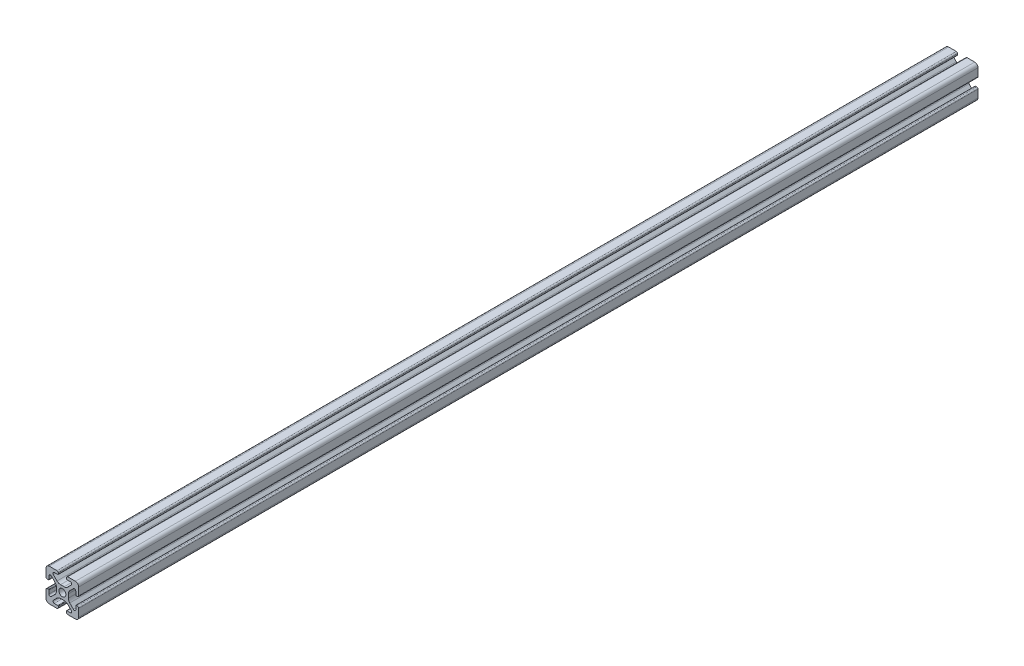
from build123d import *

# Parameters (mm, degrees)
BOSS_EXTRU_1_DEPTH = 550


with BuildPart() as part:
    # Esquisse1 → Boss.-Extru.1 (new body)
    with BuildSketch(Plane.XY):
        with BuildLine():
            Line((-3.255887446, 4.528679645), (-5.506192286, 6.778984485))
            ThreePointArc((-5.506192286, 6.778984485), (-5.686636441, 7.686138511), (-4.917588391, 8.199999989))
            Line((-4.917588391, 8.199999989), (-2.799999991, 8.199999989))
            ThreePointArc((-2.799999991, 8.199999989), (-2.587867957, 8.287867955), (-2.499999991, 8.499999989))
            Line((-2.499999991, 8.499999989), (-2.499999991, 9.199999989))
            ThreePointArc((-2.499999991, 9.199999989), (-2.734314566, 9.765685414), (-3.299999991, 9.999999989))
            Line((-3.299999991, 9.999999989), (-7.999999991, 9.999999989))
            ThreePointArc((-7.999999991, 9.999999989), (-9.414213554, 9.414213552), (-9.999999991, 7.999999989))
            Line((-9.999999991, 7.999999989), (-9.999999991, 3.299999989))
            ThreePointArc((-9.999999991, 3.299999989), (-9.765685416, 2.734314564), (-9.199999991, 2.499999989))
            Line((-9.199999991, 2.499999989), (-8.499999991, 2.499999989))
            ThreePointArc((-8.499999991, 2.499999989), (-8.287867957, 2.587867955), (-8.199999991, 2.799999989))
            Line((-8.199999991, 2.799999989), (-8.199999991, 4.917588389))
            ThreePointArc((-8.199999991, 4.917588389), (-7.686138517, 5.686636433), (-6.778984497, 5.506192279))
            Line((-6.778984497, 5.506192279), (-4.528679657, 3.255887439))
            ThreePointArc((-4.528679657, 3.255887439), (-3.878361403, 2.282617393), (-3.650000001, 1.134567096))
            Line((-3.650000001, 1.134567096), (-3.650000001, -1.134567114))
            ThreePointArc((-3.650000001, -1.134567114), (-3.878361403, -2.282617409), (-4.528679656, -3.255887454))
            Line((-4.528679656, -3.255887454), (-6.778984496, -5.506192294))
            ThreePointArc((-6.778984496, -5.506192294), (-7.686138522, -5.686636449), (-8.2, -4.9175884))
            Line((-8.2, -4.9175884), (-8.2, -2.8))
            ThreePointArc((-8.2, -2.8), (-8.287867966, -2.587867966), (-8.5, -2.5))
            Line((-8.5, -2.5), (-9.2, -2.5))
            ThreePointArc((-9.2, -2.5), (-9.765685425, -2.734314575), (-10, -3.3))
            Line((-10, -3.3), (-10, -8))
            ThreePointArc((-10, -8), (-9.414213562, -9.414213562), (-8, -10))
            Line((-8, -10), (-3.3, -10))
            ThreePointArc((-3.3, -10), (-2.734314575, -9.765685425), (-2.5, -9.2))
            Line((-2.5, -9.2), (-2.5, -8.5))
            ThreePointArc((-2.5, -8.5), (-2.587867966, -8.287867966), (-2.8, -8.2))
            Line((-2.8, -8.2), (-4.9175884, -8.2))
            ThreePointArc((-4.9175884, -8.2), (-5.686636444, -7.686138526), (-5.50619229, -6.778984506))
            Line((-5.50619229, -6.778984506), (-3.25588745, -4.528679666))
            ThreePointArc((-3.25588745, -4.528679666), (-2.282617404, -3.878361412), (-1.134567106, -3.650000009))
            Line((-1.134567106, -3.650000009), (1.134567104, -3.650000009))
            ThreePointArc((1.134567104, -3.650000009), (2.282617399, -3.878361412), (3.255887444, -4.528679664))
            Line((3.255887444, -4.528679664), (5.506192284, -6.778984504))
            ThreePointArc((5.506192284, -6.778984504), (5.686636439, -7.686138531), (4.917588389, -8.200000009))
            Line((4.917588389, -8.200000009), (2.799999989, -8.200000009))
            ThreePointArc((2.799999989, -8.200000009), (2.587867955, -8.287867974), (2.499999989, -8.500000009))
            Line((2.499999989, -8.500000009), (2.499999989, -9.200000009))
            ThreePointArc((2.499999989, -9.200000009), (2.734314564, -9.765685434), (3.299999989, -10.000000009))
            Line((3.299999989, -10.000000009), (7.999999989, -10.000000009))
            ThreePointArc((7.999999989, -10.000000009), (9.414213552, -9.414213571), (9.999999989, -8.000000009))
            Line((9.999999989, -8.000000009), (9.999999989, -3.300000009))
            ThreePointArc((9.999999989, -3.300000009), (9.765685414, -2.734314584), (9.199999989, -2.500000009))
            Line((9.199999989, -2.500000009), (8.499999989, -2.500000009))
            ThreePointArc((8.499999989, -2.500000009), (8.287867955, -2.587867974), (8.199999989, -2.800000009))
            Line((8.199999989, -2.800000009), (8.199999989, -4.917588409))
            ThreePointArc((8.199999989, -4.917588409), (7.686138515, -5.686636452), (6.778984495, -5.506192299))
            Line((6.778984495, -5.506192299), (4.528679655, -3.255887459))
            ThreePointArc((4.528679655, -3.255887459), (3.878361401, -2.282617412), (3.649999999, -1.134567115))
            Line((3.649999999, -1.134567115), (3.649999999, 1.134567095))
            ThreePointArc((3.649999999, 1.134567095), (3.878361401, 2.28261739), (4.528679654, 3.255887435))
            Line((4.528679654, 3.255887435), (6.778984494, 5.506192275))
            ThreePointArc((6.778984494, 5.506192275), (7.68613852, 5.68663643), (8.199999998, 4.917588381))
            Line((8.199999998, 4.917588381), (8.199999998, 2.799999981))
            ThreePointArc((8.199999998, 2.799999981), (8.287867964, 2.587867946), (8.499999998, 2.499999981))
            Line((8.499999998, 2.499999981), (9.199999998, 2.499999981))
            ThreePointArc((9.199999998, 2.499999981), (9.765685423, 2.734314556), (9.999999998, 3.299999981))
            Line((9.999999998, 3.299999981), (9.999999998, 7.999999981))
            ThreePointArc((9.999999998, 7.999999981), (9.41421356, 9.414213543), (7.999999998, 9.999999981))
            Line((7.999999998, 9.999999981), (3.299999998, 9.999999981))
            ThreePointArc((3.299999998, 9.999999981), (2.734314573, 9.765685406), (2.499999998, 9.199999981))
            Line((2.499999998, 9.199999981), (2.499999998, 8.499999981))
            ThreePointArc((2.499999998, 8.499999981), (2.587867964, 8.287867946), (2.799999998, 8.199999981))
            Line((2.799999998, 8.199999981), (4.917588398, 8.199999981))
            ThreePointArc((4.917588398, 8.199999981), (5.686636442, 7.686138507), (5.506192288, 6.778984487))
            Line((5.506192288, 6.778984487), (3.255887448, 4.528679647))
            ThreePointArc((3.255887448, 4.528679647), (2.282617402, 3.878361393), (1.134567104, 3.64999999))
            Line((1.134567104, 3.64999999), (-1.134567106, 3.64999999))
            ThreePointArc((-1.134567106, 3.64999999), (-2.282617401, 3.878361392), (-3.255887446, 4.528679645))
        make_face()
        with BuildLine():
            ThreePointArc((-2.15, 0), (0, -2.15), (2.15, 0))
            ThreePointArc((2.15, 0), (0, 2.15), (-2.15, 0))
        make_face(mode=Mode.SUBTRACT)
    extrude(amount=BOSS_EXTRU_1_DEPTH)


solid = part.part
